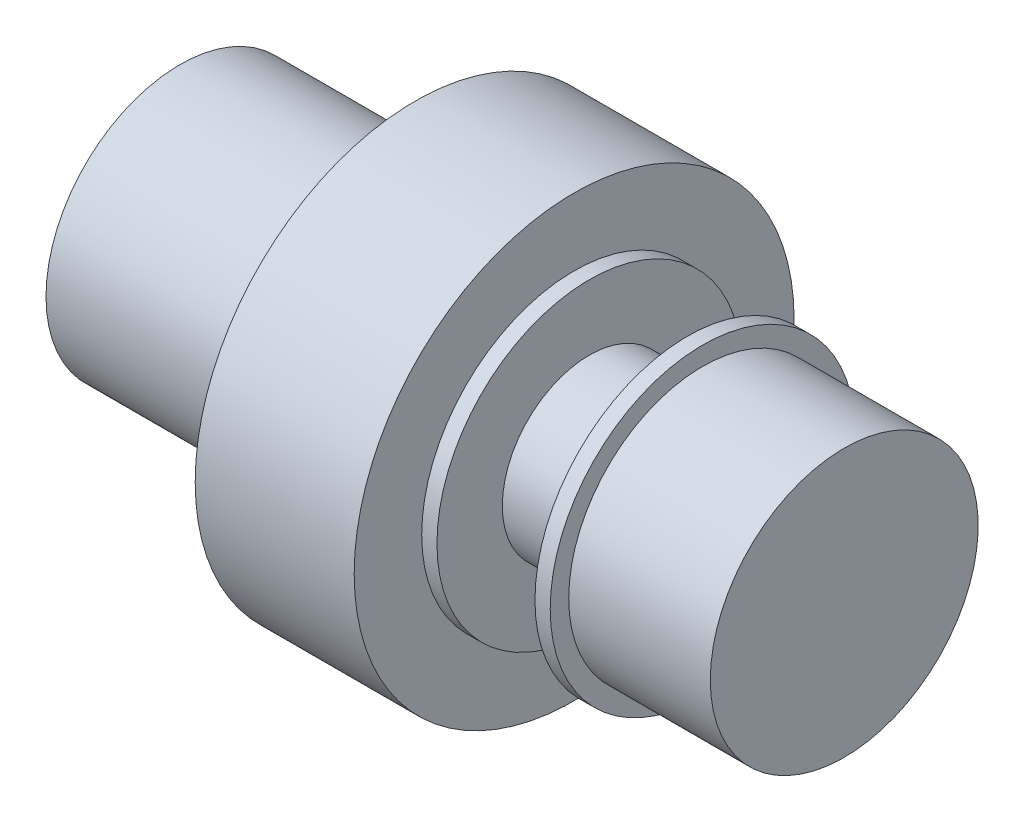
from build123d import *

# Parameters (mm, degrees)
FORO_PER_VITE_M5_1_D           = 5.5
FORO_PER_VITE_M5_1_DEPTH       = 15.347633298
FORO_PER_VITE_M5_1_CSINK_D     = 5.55
FORO_PER_VITE_M5_1_CSINK_ANGLE = 90
FORO_PER_VITE_M5_1_TIP         = 1.652366702


with BuildPart() as part:
    # Schizzo1 → Rivoluzione1 (revolve)
    with BuildSketch(Plane.XY, mode=Mode.PRIVATE) as rivoluzione1_sk:
        Polygon((-152.5, 0), (152.5, 0), (152.5, 61.5), (87.5, 61.5), (87.5, 70), (80.5, 70), (80.5, 40), (35.5, 40), (35.5, 70), (28.5, 70), (28.5, 101), (-44.5, 101), (-44.5, 61.5), (-152.5, 61.5), align=None)
    revolve(rivoluzione1_sk.sketch.rotate(Axis((-1716.324322208, 0, 0), (1, 0, 0)), 90), axis=Axis((-1716.324322208, 0, 0), (1, 0, 0)))

    # Foro per Vite M5-1
    with Locations(Plane(origin=(-44.5, 96, 0), x_dir=(0, 0, -1), z_dir=(-1, 0, 0))):
        with Locations((0, 0), (-96, 96), (0, 192), (96, 96)):
            CounterSinkHole(FORO_PER_VITE_M5_1_D / 2, FORO_PER_VITE_M5_1_CSINK_D / 2, depth=FORO_PER_VITE_M5_1_DEPTH, counter_sink_angle=FORO_PER_VITE_M5_1_CSINK_ANGLE)
            with Locations((0, 0, -(FORO_PER_VITE_M5_1_DEPTH + FORO_PER_VITE_M5_1_TIP / 2))):  # 118° drill point
                Cone(0, FORO_PER_VITE_M5_1_D / 2, FORO_PER_VITE_M5_1_TIP, mode=Mode.SUBTRACT)


solid = part.part
